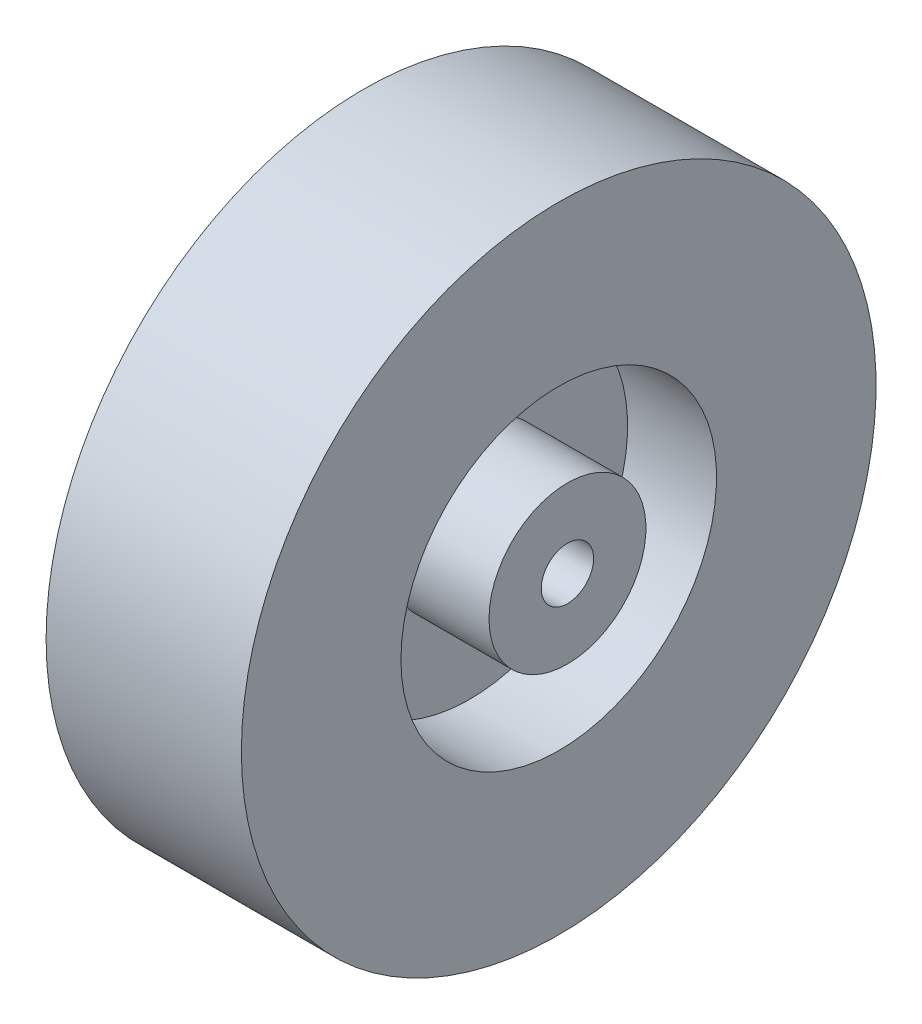
from build123d import *

# Parameters (mm, degrees)
SKETCH2_R          = 3
CUT_EXTRUDE1_DEPTH = 15
ECHELLE1_SCALE     = 0.5


with BuildPart() as part:
    # Sketch1 → Revolve1 (revolve)
    with BuildSketch(Plane.XY, mode=Mode.PRIVATE) as revolve1_sk:
        Polygon((-11.2, 18.1), (-1, 18.1), (-1, 9), (-12.2, 9), (-12.2, 0), (12.2, 0), (12.2, 9), (1, 9), (1, 18.1), (11.2, 18.1), (11.2, 36.4), (-11.2, 36.4), align=None)
    revolve(revolve1_sk.sketch.rotate(Axis((0, 0, 0), (1, 0, 0)), 90), axis=Axis((0, 0, 0), (1, 0, 0)))

    # Sketch2 → Cut-Extrude1 (cut)
    with BuildSketch(Plane(origin=(12.2, 0, 0), x_dir=(0, 0, -1), z_dir=(1, 0, 0))):
        Circle(SKETCH2_R)
    extrude(amount=-CUT_EXTRUDE1_DEPTH, mode=Mode.SUBTRACT)


with BuildPart() as part_1:
    # Echelle1: scaled about (-0.025714015, 0, 0)
    add(part.part.scale(ECHELLE1_SCALE).moved(Location((-0.012857007, 0, 0))))


solid = part_1.part
